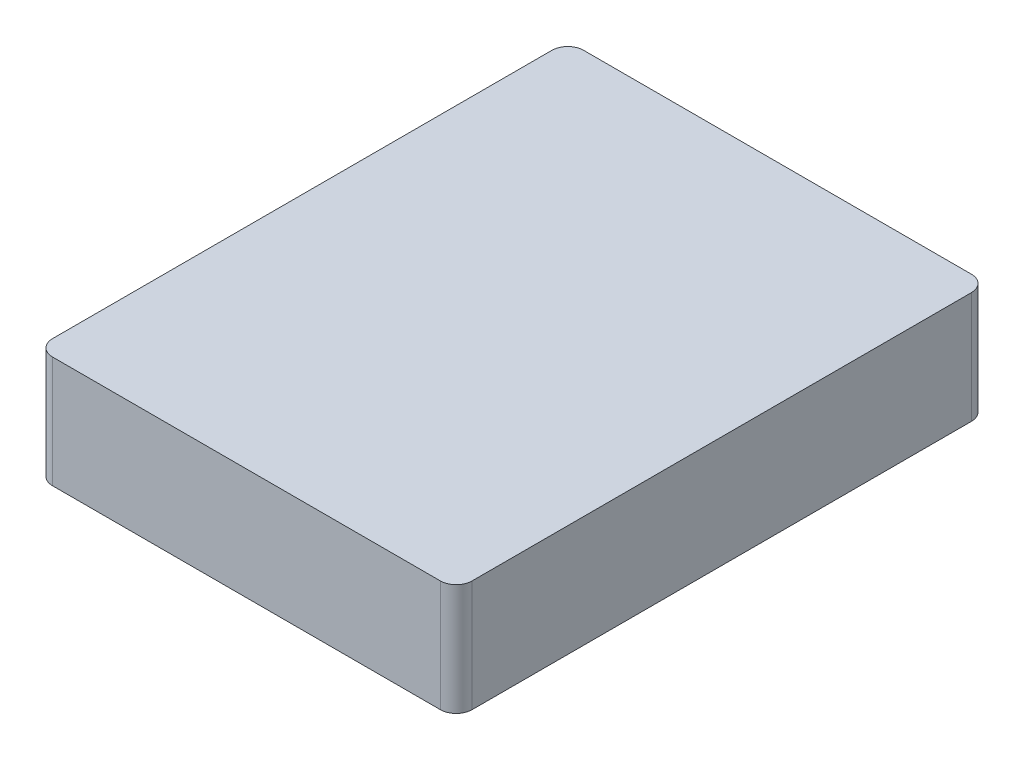
from build123d import *

# Parameters (mm, degrees)
BOSS_EXTRUDE1_DEPTH = 21


with BuildPart() as part:
    # Sketch1 → Boss-Extrude1 (new body)
    with BuildSketch(Plane(origin=(0, 0, 0), x_dir=(1, 0, 0), z_dir=(0, 1, 0))):
        with BuildLine():
            Line((-36.5, 50), (36.5, 50))
            ThreePointArc((36.5, 50), (38.621320344, 49.121320344), (39.5, 47))
            Line((39.5, 47), (39.5, -47))
            ThreePointArc((39.5, -47), (38.621320344, -49.121320344), (36.5, -50))
            Line((36.5, -50), (-36.5, -50))
            ThreePointArc((-36.5, -50), (-38.621320344, -49.121320344), (-39.5, -47))
            Line((-39.5, -47), (-39.5, 47))
            ThreePointArc((-39.5, 47), (-38.621320344, 49.121320344), (-36.5, 50))
        make_face()
    extrude(amount=BOSS_EXTRUDE1_DEPTH)


solid = part.part
